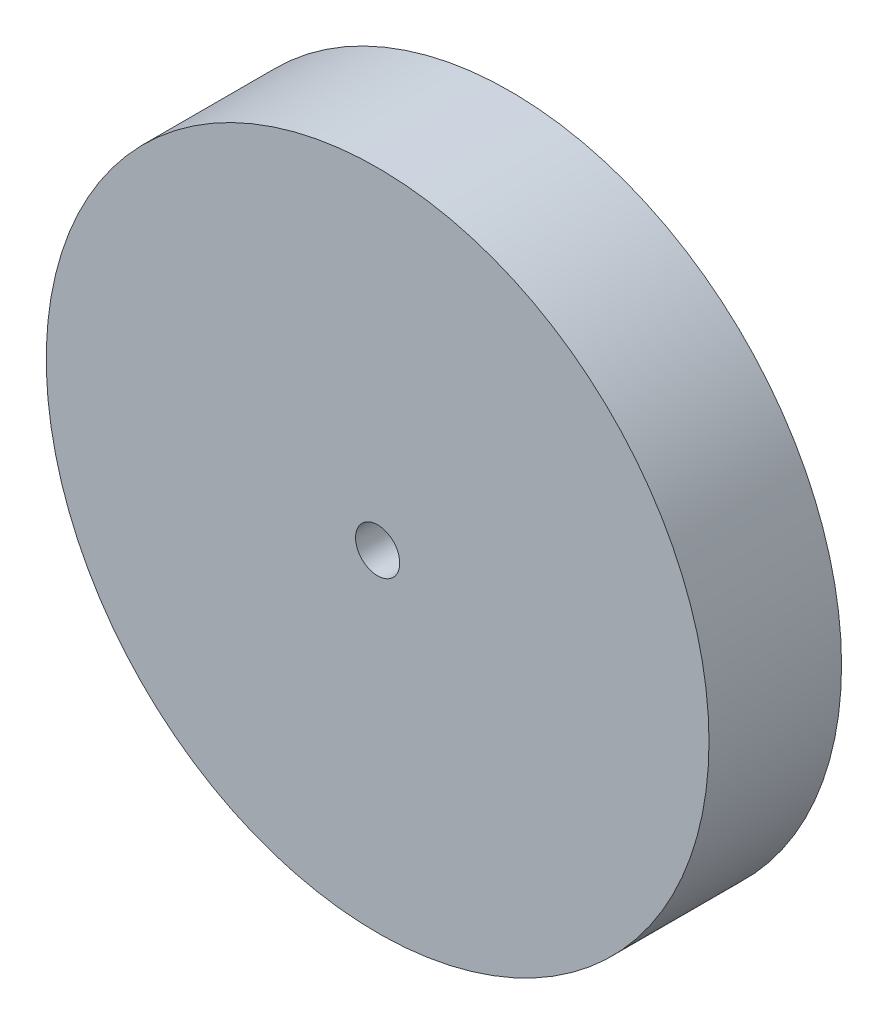
from build123d import *

# Parameters (mm, degrees)
SKETCH_1_R      = 75
SKETCH_1_R_2    = 5
EXTRUDE_1_DEPTH = 30


with BuildPart() as part:
    # 草图1 → 凸台-拉伸1 (new body)
    with BuildSketch(Plane.XY):
        Circle(SKETCH_1_R)
        Circle(SKETCH_1_R_2, mode=Mode.SUBTRACT)
    extrude(amount=EXTRUDE_1_DEPTH)


solid = part.part
